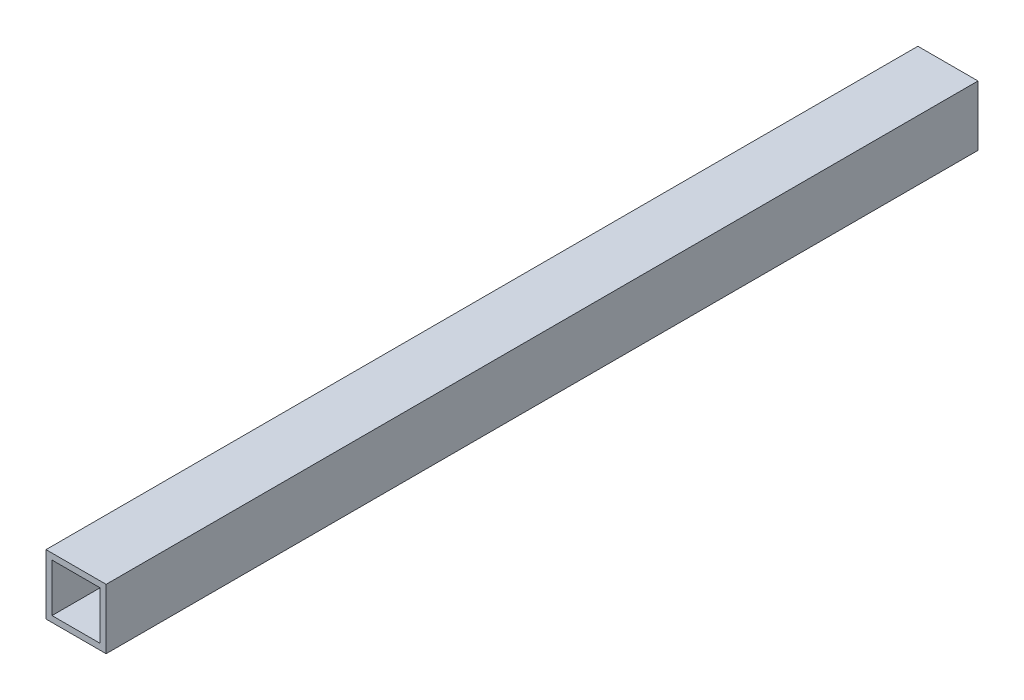
from build123d import *

# Parameters (mm, degrees)
SKETCH1_W           = 25.4
SKETCH1_H           = 25.4
SKETCH1_W_2         = 20.32
SKETCH1_H_2         = 20.32
BOSS_EXTRUDE1_DEPTH = 184.15


with BuildPart() as part:
    # Sketch1 → Boss-Extrude1 (new, symmetric)
    with BuildSketch(Plane.XY):
        Rectangle(SKETCH1_W, SKETCH1_H)
        Rectangle(SKETCH1_W_2, SKETCH1_H_2, mode=Mode.SUBTRACT)
    extrude(amount=BOSS_EXTRUDE1_DEPTH, both=True)


solid = part.part
